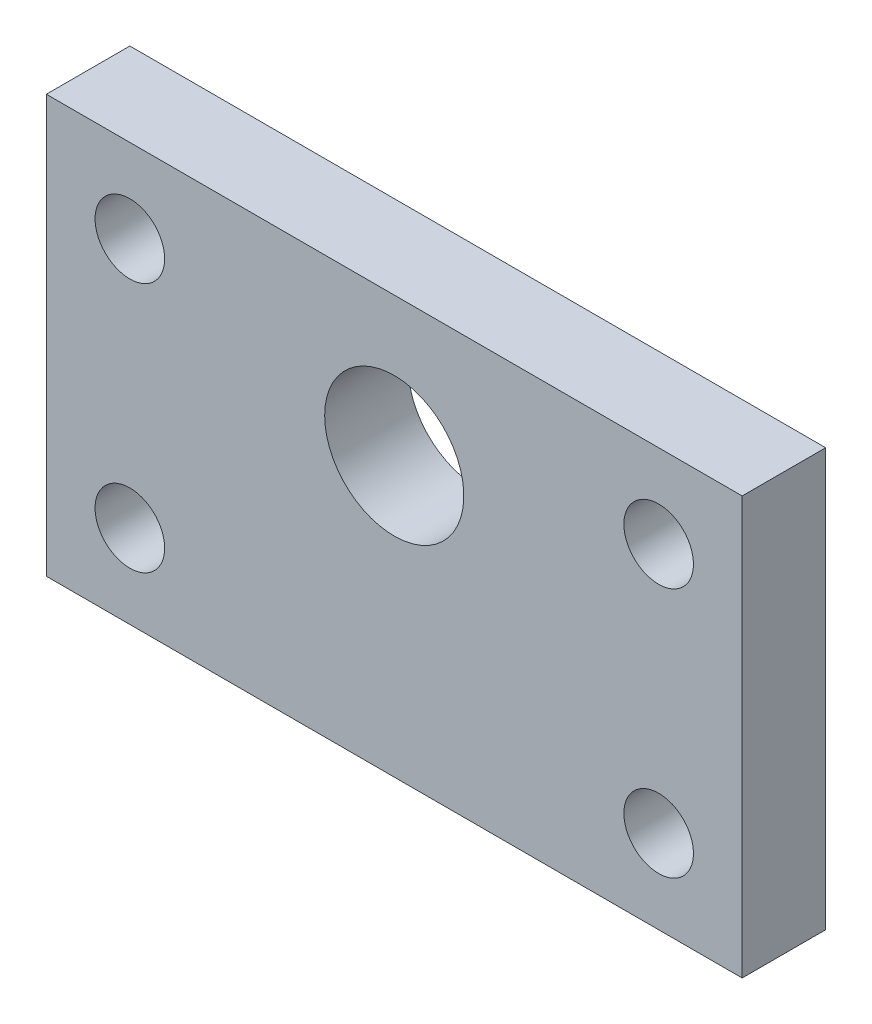
from build123d import *

# Parameters (mm, degrees)
SKETCH1_W           = 250
SKETCH1_H           = 150
SKETCH1_R           = 12.5
SKETCH1_R_2         = 25
BOSS_EXTRUDE1_DEPTH = 30


with BuildPart() as part:
    # Sketch1 → Boss-Extrude1 (new body)
    with BuildSketch(Plane.XY):
        Rectangle(SKETCH1_W, SKETCH1_H)
        with Locations((-95, 45)):
            Circle(SKETCH1_R, mode=Mode.SUBTRACT)
        with Locations((-95, -45)):
            Circle(SKETCH1_R, mode=Mode.SUBTRACT)
        with Locations(Location((95, -45, 0), (0, 0, 180))):
            Circle(SKETCH1_R, mode=Mode.SUBTRACT)
        with Locations(Location((95, 45, 0), (0, 0, 180))):
            Circle(SKETCH1_R, mode=Mode.SUBTRACT)
        with Locations(Location((0, 25, 0), (0, 0, 180))):
            Circle(SKETCH1_R_2, mode=Mode.SUBTRACT)
    extrude(amount=BOSS_EXTRUDE1_DEPTH)


solid = part.part
